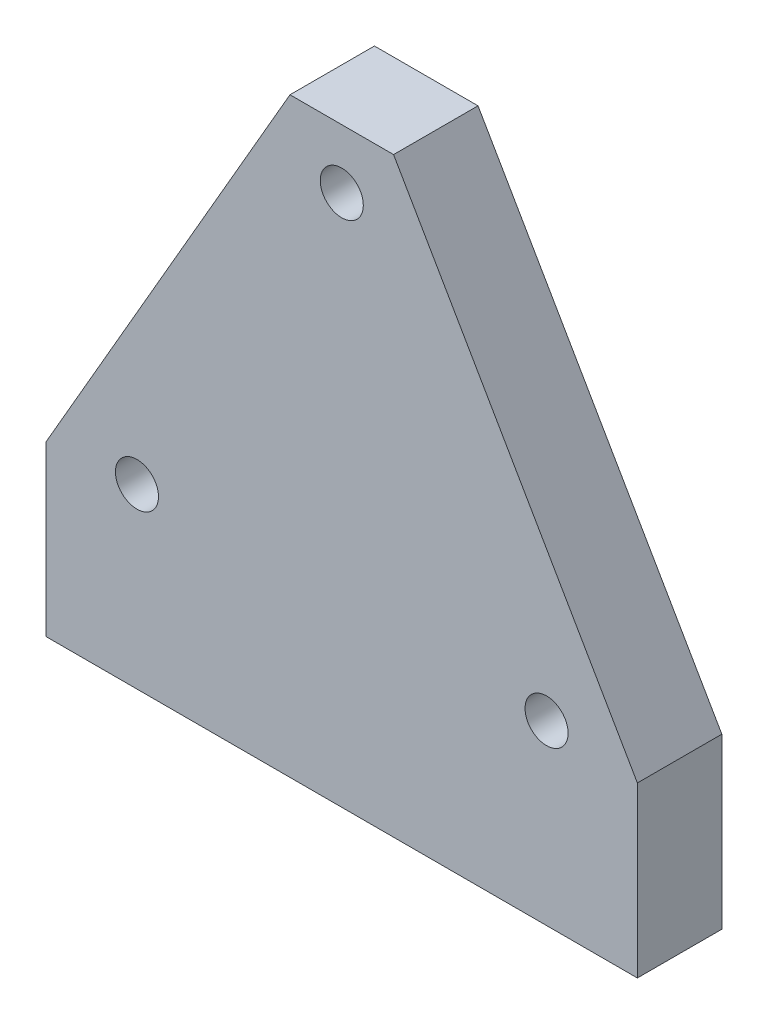
from build123d import *

# Parameters (mm, degrees)
SKIZZE2_W                       = 70
SKIZZE2_H                       = 70
AUFSATZ_LINEAR_AUSTRAGEN2_DEPTH = 10
SKIZZE5_R                       = 2.55
SCHNITT_LINEAR_AUSTRAGEN1_DEPTH = 10
FASE2_SIZE                      = 50
FASE2_SIZE2                     = 28.867513459
FASE3_SIZE                      = 50
FASE3_SIZE2                     = 28.867513459


with BuildPart() as part:
    # Skizze2 → Aufsatz-Linear austragen2 (new body)
    with BuildSketch(Plane.XY):
        with Locations((35, 35)):
            Rectangle(SKIZZE2_W, SKIZZE2_H)
    extrude(amount=AUFSATZ_LINEAR_AUSTRAGEN2_DEPTH)

    # Skizze5 → Schnitt-Linear austragen1 (cut)
    with BuildSketch(Plane.XY.offset(10)):
        with Locations((35, 63)):
            Circle(SKIZZE5_R)
        with Locations((59.248711306, 21)):
            Circle(SKIZZE5_R)
        with Locations((10.751288694, 21)):
            Circle(SKIZZE5_R)
    extrude(amount=-SCHNITT_LINEAR_AUSTRAGEN1_DEPTH, mode=Mode.SUBTRACT)

    # Fase2
    fase2_edges = [part.edges().sort_by_distance(p)[0] for p in [
        (70, 70, 5),
    ]]
    fase2_side = [part.faces().sort_by_distance(p)[0] for p in [
        (70, 35, 5),
    ]]
    chamfer(fase2_edges, length=FASE2_SIZE, length2=FASE2_SIZE2, reference=fase2_side[0])

    # Fase3
    fase3_edges = [part.edges().sort_by_distance(p)[0] for p in [
        (0, 70, 5),
    ]]
    fase3_side = [part.faces().sort_by_distance(p)[0] for p in [
        (0, 35, 5),
    ]]
    chamfer(fase3_edges, length=FASE3_SIZE, length2=FASE3_SIZE2, reference=fase3_side[0])


solid = part.part
